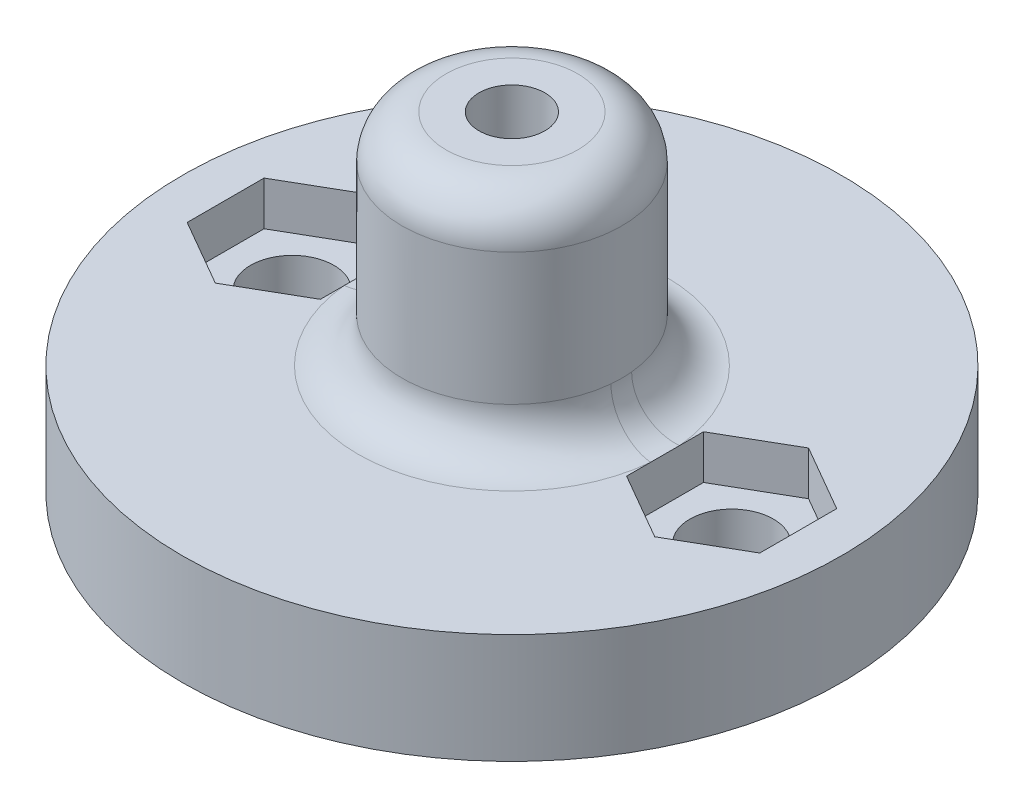
from build123d import *

# Parameters (mm, degrees)
SKETCH_1_R          = 15
EXTRUDE_1_DEPTH     = 5
SKETCH_2_R          = 1.9
CUT_EXTRUDE_1_DEPTH = 5
CUT_EXTRUDE_2_DEPTH = 2
SKETCH_4_R          = 5
EXTRUDE_2_DEPTH     = 10
FILLET_1_R          = 2
SKETCH_5_R          = 1.5
CUT_EXTRUDE_3_DEPTH = 15
CUT_EXTRUDE_4_DEPTH = 2.7


with BuildPart() as part:
    # Эскиз1 → Бобышка-Вытянуть1 (new body)
    with BuildSketch(Plane(origin=(0, 0, 0), x_dir=(1, 0, 0), z_dir=(0, 1, 0))):
        with Locations(Location((0, 0, 0), (0, 0, 270))):
            Circle(SKETCH_1_R)
    extrude(amount=EXTRUDE_1_DEPTH)

    # Эскиз2 → Вырез-Вытянуть1 (cut)
    with BuildSketch(Plane(origin=(0, 5, 0), x_dir=(1, 0, 0), z_dir=(0, 1, 0))):
        with Locations(Location((-10, 0, 0), (0, 0, 270))):
            Circle(SKETCH_2_R)
        with Locations(Location((10, 0, 0), (0, 0, 270))):
            Circle(SKETCH_2_R)
    extrude(amount=-CUT_EXTRUDE_1_DEPTH, mode=Mode.SUBTRACT)

    # Эскиз3 → Вырез-Вытянуть2 (cut)
    with BuildSketch(Plane(origin=(0, 5, 0), x_dir=(1, 0, 0), z_dir=(0, 1, 0))):
        Polygon((-10, -3.5), (-6.968911087, -1.75), (-6.968911087, 1.75), (-10, 3.5), (-13.031088913, 1.75), (-13.031088913, -1.75), align=None)
        Polygon((10, -3.5), (13.031088913, -1.75), (13.031088913, 1.75), (10, 3.5), (6.968911087, 1.75), (6.968911087, -1.75), align=None)
    extrude(amount=-CUT_EXTRUDE_2_DEPTH, mode=Mode.SUBTRACT)

    # Эскиз4 → Бобышка-Вытянуть2 (add)
    with BuildSketch(Plane(origin=(0, 5, 0), x_dir=(1, 0, 0), z_dir=(0, 1, 0))):
        with Locations(Location((0, 0, 0), (0, 0, 270))):
            Circle(SKETCH_4_R)
    extrude(amount=EXTRUDE_2_DEPTH)

    # Скругление1
    fillet_1_edges = [part.edges().sort_by_distance(p)[0] for p in [
        (0, 5, -5),
        (0, 15, -5),
    ]]
    fillet(fillet_1_edges, radius=FILLET_1_R)

    # Эскиз5 → Вырез-Вытянуть3 (cut)
    with BuildSketch(Plane.XZ):
        with Locations(Location((0, 0, 0), (0, 0, 270))):
            Circle(SKETCH_5_R)
    extrude(amount=-CUT_EXTRUDE_3_DEPTH, mode=Mode.SUBTRACT)

    # Эскиз6 → Вырез-Вытянуть4 (cut)
    with BuildSketch(Plane.XZ):
        Polygon((0, 3.5), (-3.031088913, 1.75), (-3.031088913, -1.75), (0, -3.5), (3.031088913, -1.75), (3.031088913, 1.75), align=None)
    extrude(amount=-CUT_EXTRUDE_4_DEPTH, mode=Mode.SUBTRACT)


solid = part.part
